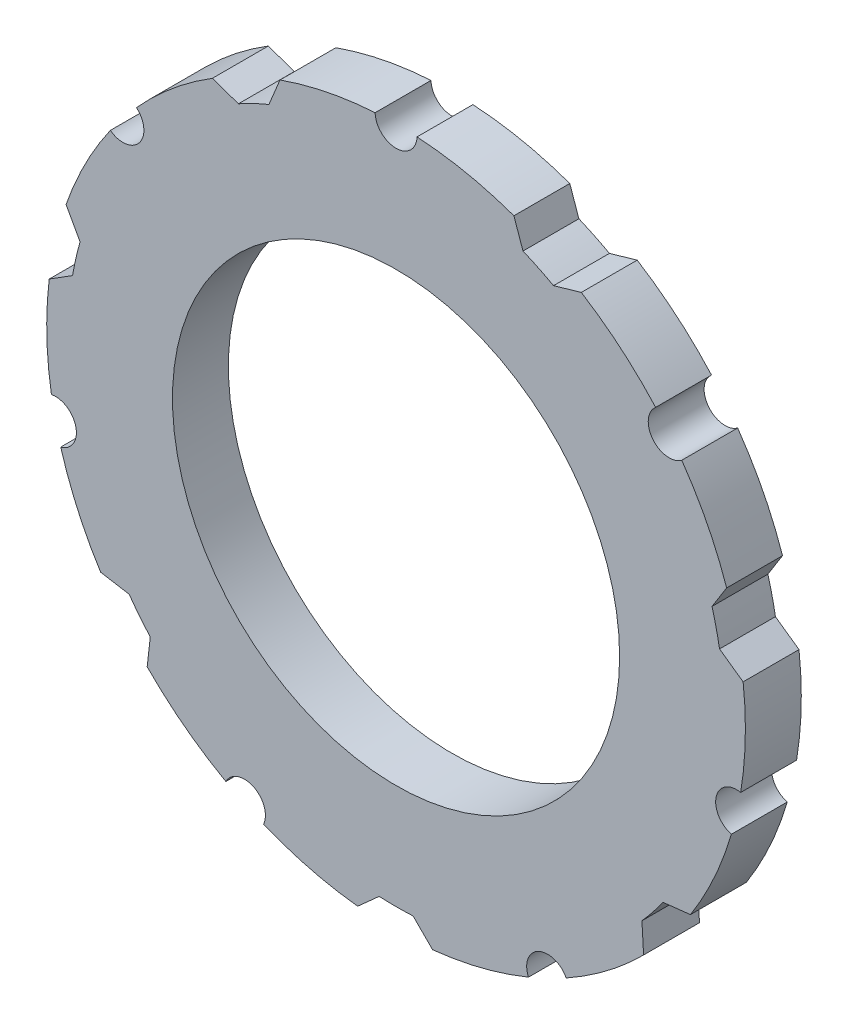
from build123d import *

# Parameters (mm, degrees)
SKETCH1_R           = 16
BOSS_EXTRUDE1_DEPTH = 4


with BuildPart() as part:
    # Sketch1 → Boss-Extrude1 (new body)
    with BuildSketch(Plane.XY):
        with BuildLine():
            Line((24.836944886, 2.850643567), (23.14914702, 4.045613953))
            ThreePointArc((23.14914702, 4.045613953), (22.909534515, 5.234809289), (22.60887418, 6.410055249))
            Line((22.60887418, 6.410055249), (23.658232882, 8.080100055))
            ThreePointArc((23.658232882, 8.080100055), (22.276156802, 11.347812041), (20.445418397, 14.386968637))
            ThreePointArc((20.445418397, 14.386968637), (18.373039838, 14.652010344), (18.575790893, 16.731407374))
            ThreePointArc((18.575790893, 16.731407374), (16.072080469, 19.149105186), (13.25685896, 21.195652633))
            Line((13.25685896, 21.195652633), (11.270268735, 20.621130974))
            ThreePointArc((11.270268735, 20.621130974), (10.191122428, 21.175245539), (9.084819485, 21.672933694))
            Line((9.084819485, 21.672933694), (8.433390327, 23.534611269))
            ThreePointArc((8.433390327, 23.534611269), (5.01687988, 24.491445778), (1.499324848, 24.955))
            ThreePointArc((1.499324848, 24.955), (0, 23.5), (-1.499324848, 24.955))
            ThreePointArc((-1.499324848, 24.955), (-4.950595028, 24.504930297), (-8.305912153, 23.579902954))
            Line((-8.305912153, 23.579902954), (-9.095351779, 21.668515778))
            ThreePointArc((-9.095351779, 21.668515778), (-10.201412708, 21.170290002), (-11.280289579, 20.615651021))
            Line((-11.280289579, 20.615651021), (-13.141967154, 21.267080179))
            ThreePointArc((-13.141967154, 21.267080179), (-16.020209918, 19.192521309), (-18.575790893, 16.731407374))
            ThreePointArc((-18.575790893, 16.731407374), (-18.373039838, 14.652010344), (-20.445418397, 14.386968637))
            ThreePointArc((-20.445418397, 14.386968637), (-22.245371495, 11.408043085), (-23.614162005, 8.208005408))
            Line((-23.614162005, 8.208005408), (-22.611986892, 6.399066244))
            ThreePointArc((-22.611986892, 6.399066244), (-22.912076004, 5.223674298), (-23.151110514, 4.034362646))
            Line((-23.151110514, 4.034362646), (-24.821155321, 2.985003945))
            ThreePointArc((-24.821155321, 2.985003945), (-24.993754895, -0.558763162), (-24.662957214, -4.091276263))
            ThreePointArc((-24.662957214, -4.091276263), (-22.910805936, -5.229241948), (-23.995694883, -7.014743551))
            ThreePointArc((-23.995694883, -7.014743551), (-22.788929503, -10.279333251), (-21.140466226, -13.344687622))
            Line((-21.140466226, -13.344687622), (-19.101334675, -13.689010689))
            ThreePointArc((-19.101334675, -13.689010689), (-18.369478748, -14.656474696), (-17.588673036, -15.584883087))
            Line((-17.588673036, -15.584883087), (-17.809507272, -17.544841143))
            ThreePointArc((-17.809507272, -17.544841143), (-15.146492656, -19.889287575), (-12.178413721, -21.833145427))
            ThreePointArc((-12.178413721, -21.833145427), (-10.196267869, -21.172768396), (-9.476723699, -23.13421077))
            ThreePointArc((-9.476723699, -23.13421077), (-6.171958786, -24.22616199), (-2.747568192, -24.848558691))
            Line((-2.747568192, -24.848558691), (-1.206987851, -23.468983368))
            ThreePointArc((-1.206987851, -23.468983368), (0.005710674, -23.499999306), (1.218393982, -23.468393982))
            Line((1.218393982, -23.468393982), (2.613063, -24.863063))
            ThreePointArc((2.613063, -24.863063), (6.106387485, -24.242772776), (9.476723699, -23.13421077))
            ThreePointArc((9.476723699, -23.13421077), (10.196267869, -21.172768396), (12.178413721, -21.833145427))
            ThreePointArc((12.178413721, -21.833145427), (15.092622782, -19.930196626), (17.714304731, -17.640958247))
            Line((17.714304731, -17.640958247), (17.596245443, -15.576332891))
            ThreePointArc((17.596245443, -15.576332891), (18.376599843, -14.647545126), (19.107985481, -13.679725541))
            Line((19.107985481, -13.679725541), (21.067943537, -13.458891304))
            ThreePointArc((21.067943537, -13.458891304), (22.761033302, -10.340955615), (23.995694883, -7.014743551))
            ThreePointArc((23.995694883, -7.014743551), (22.910805936, -5.229241948), (24.662957214, -4.091276263))
            ThreePointArc((24.662957214, -4.091276263), (24.992151562, -0.626386701), (24.836944886, 2.850643567))
        make_face()
        Circle(SKETCH1_R, mode=Mode.SUBTRACT)
    extrude(amount=BOSS_EXTRUDE1_DEPTH)


solid = part.part
